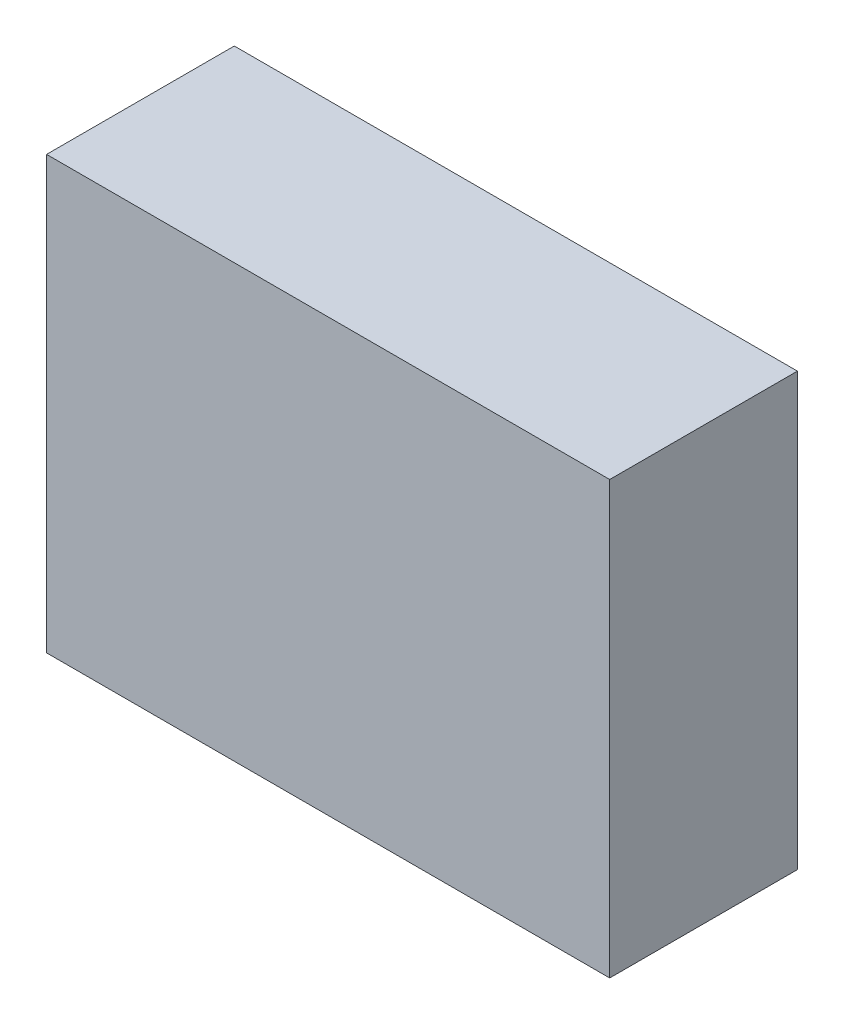
from build123d import *

# Parameters (mm, degrees)
SKETCH_1_W      = 60
SKETCH_1_H      = 46
EXTRUDE_1_DEPTH = 20


with BuildPart() as part:
    # 草图1 → 凸台-拉伸1 (new body)
    with BuildSketch(Plane.XY):
        with Locations((5, 3)):
            Rectangle(SKETCH_1_W, SKETCH_1_H)
    extrude(amount=EXTRUDE_1_DEPTH)


solid = part.part
